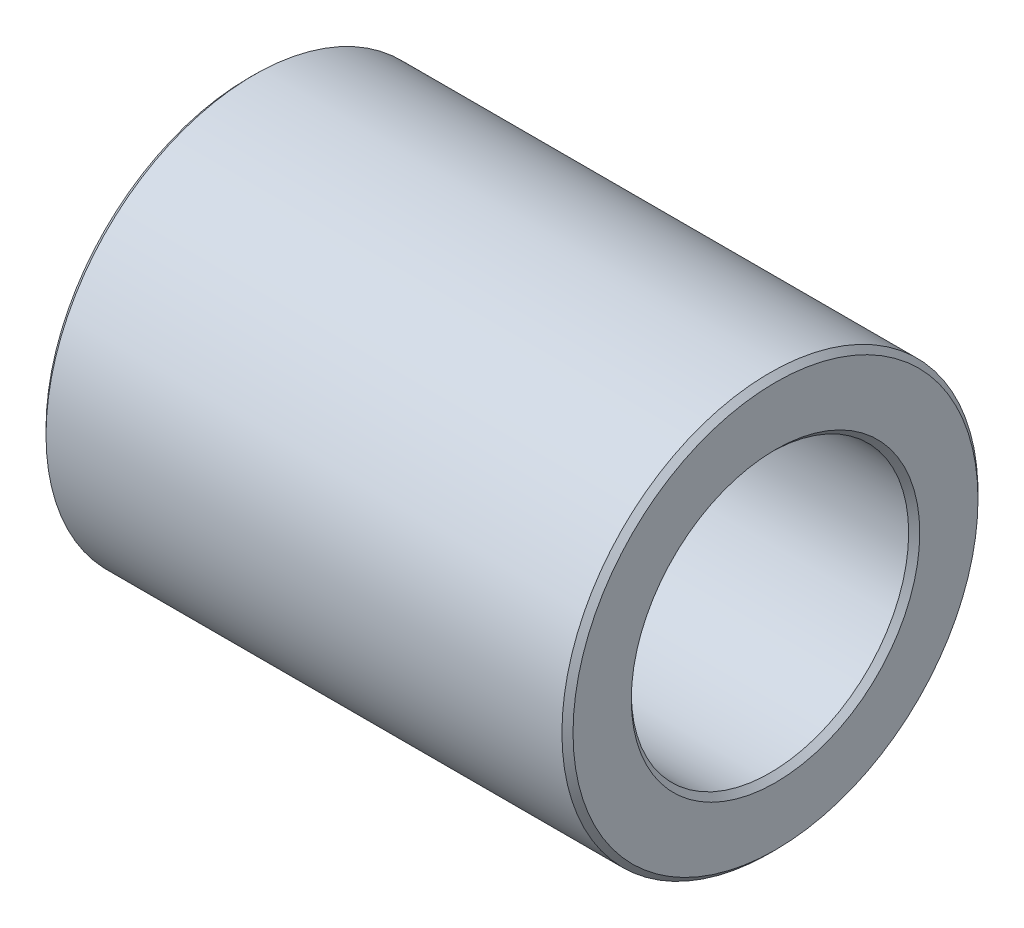
from build123d import *

# Parameters (mm, degrees)
SKIZZE2_W  = 19
SKIZZE2_H  = 2.5
FASE1_SIZE = 0.2


with BuildPart() as part:
    # Skizze2 → Rotation1 (revolve)
    with BuildSketch(Plane(origin=(0, 0, 0), x_dir=(1, 0, 0), z_dir=(0, 1, 0)), mode=Mode.PRIVATE) as rotation1_sk:
        with Locations((9.5, 6.25)):
            Rectangle(SKIZZE2_W, SKIZZE2_H)
        with Locations((9.5, -6.25)):
            Rectangle(SKIZZE2_W, SKIZZE2_H)
    revolve(rotation1_sk.sketch.rotate(Axis((0, 0, 0), (1, 0, 0)), 180), axis=Axis((0, 0, 0), (1, 0, 0)))

    # Fase1
    fase1_edges = [part.edges().sort_by_distance(p)[0] for p in [
        (0, 0, -5),
        (19, 0, -5),
        (19, 0, -7.5),
        (0, 0, -7.5),
    ]]
    chamfer(fase1_edges, length=FASE1_SIZE)


solid = part.part
